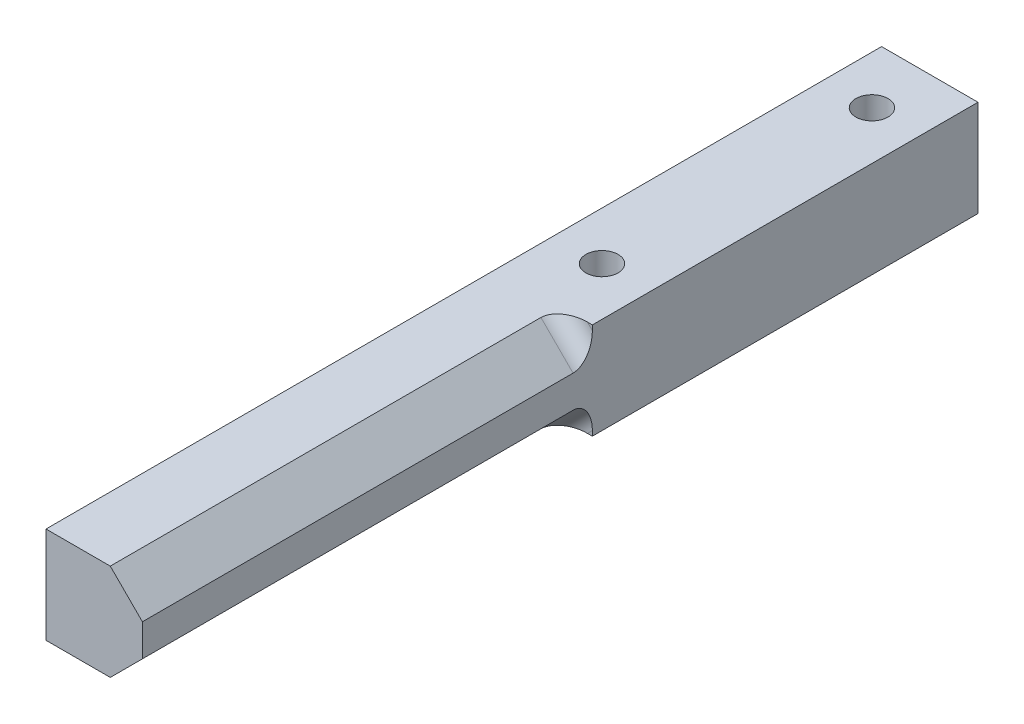
from build123d import *

# Parameters (mm, degrees)
ESQUISSE1_W             = 7.5
ESQUISSE1_H             = 7.5
BOSS_EXTRU_1_DEPTH      = 65
ESQUISSE2_R             = 1.25
ENL_V_MAT_EXTRU_1_DEPTH = 66.538633645
ENL_V_START             = -30
ENL_V_MAT_EXTRU_2_DEPTH = 36.215987304
CONG_1_R                = 1.5


with BuildPart() as part:
    # Esquisse1 → Boss.-Extru.1 (new body)
    with BuildSketch(Plane.XY):
        Rectangle(ESQUISSE1_W, ESQUISSE1_H)
    extrude(amount=BOSS_EXTRU_1_DEPTH)

    # Esquisse2 → Enlèv. mat.-Extru.1 (cut, through all)
    with BuildSketch(Plane(origin=(0, 3.75, 0), x_dir=(1, 0, 0), z_dir=(0, 1, 0))):
        with Locations(Location((0, -4.5, 0), (0, 0, 270))):
            Circle(ESQUISSE2_R)
        with Locations(Location((0, -25.5, 0), (0, 0, 270))):
            Circle(ESQUISSE2_R)
    extrude(amount=-ENL_V_MAT_EXTRU_1_DEPTH, mode=Mode.SUBTRACT)

    # Esquisse3 → Enlèv. mat.-Extru.2 (cut, through all)
    with BuildSketch(Plane(origin=(0, 0, 0), x_dir=(-1, 0, 0), z_dir=(0, 0, -1)).offset(ENL_V_START)):
        Polygon((-1.25, 3.75), (-3.75, 3.75), (-3.75, 1.25), align=None)
        Polygon((-3.75, -1.25), (-3.75, -3.75), (-1.25, -3.75), align=None)
    extrude(amount=-ENL_V_MAT_EXTRU_2_DEPTH, mode=Mode.SUBTRACT)

    # Congé1
    cong_1_edges = [part.edges().sort_by_distance(p)[0] for p in [
        (2.5, 2.5, 30),
        (2.5, -2.5, 30),
    ]]
    fillet(cong_1_edges, radius=CONG_1_R)


solid = part.part
